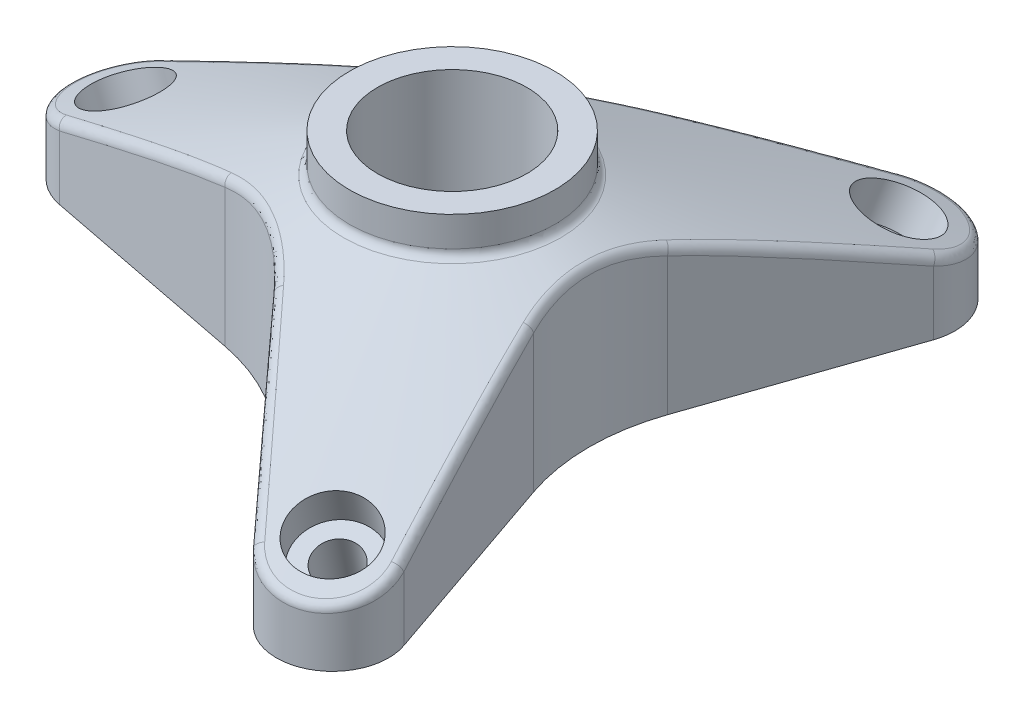
from build123d import *

# Parameters (mm, degrees)
SKETCH1_R                                = 8
BOSS_EXTRUDE1_DEPTH                      = 22
SKETCH1_3_R                              = 11
SKETCH1_3_R_2                            = 8
BOSS_EXTRUDE2_DEPTH                      = 22
CBORE_FOR_M4_SHCS1_D                     = 4.5
CBORE_FOR_M4_SHCS1_CBORE_D               = 8
CBORE_FOR_M4_SHCS1_CBORE_DEPTH           = 4
CBORE_FOR_M4_SHCS1_ON_FACE_2_D           = 4.5
CBORE_FOR_M4_SHCS1_ON_FACE_2_CBORE_D     = 8
CBORE_FOR_M4_SHCS1_ON_FACE_2_CBORE_DEPTH = 4
CBORE_FOR_M4_SHCS1_ON_FACE_3_D           = 4.5
CBORE_FOR_M4_SHCS1_ON_FACE_3_CBORE_D     = 8
CBORE_FOR_M4_SHCS1_ON_FACE_3_CBORE_DEPTH = 4
FILLET1_R                                = 1


with BuildPart() as part:
    # Sketch1 → Boss-Extrude1 (new body)
    with BuildSketch(Plane(origin=(0, 0, 0), x_dir=(1, 0, 0), z_dir=(0, 1, 0))):
        with BuildLine():
            Line((-14.140453582, 10.166985251), (-36.144853972, 5.889763101))
            ThreePointArc((-36.144853972, 5.889763101), (-41, 0), (-36.144853972, -5.889763101))
            Line((-36.144853972, -5.889763101), (-14.140453582, -10.166985251))
            ThreePointArc((-14.140453582, -10.166985251), (-7.338251481, -12.710224403), (-1.734640716, -17.329484649))
            Line((-1.734640716, -17.329484649), (12.971742519, -34.247243306))
            ThreePointArc((12.971742519, -34.247243306), (20.5, -35.507041555), (23.173111454, -28.357480206))
            Line((23.173111454, -28.357480206), (15.875094298, -7.162499398))
            ThreePointArc((15.875094298, -7.162499398), (14.676502962, 0), (15.875094298, 7.162499398))
            Line((15.875094298, 7.162499398), (23.173111454, 28.357480206))
            ThreePointArc((23.173111454, 28.357480206), (20.5, 35.507041555), (12.971742519, 34.247243306))
            Line((12.971742519, 34.247243306), (-1.734640716, 17.329484649))
            ThreePointArc((-1.734640716, 17.329484649), (-7.338251481, 12.710224403), (-14.140453582, 10.166985251))
        make_face()
        Circle(SKETCH1_R, mode=Mode.SUBTRACT)
    extrude(amount=BOSS_EXTRUDE1_DEPTH)

    # Sketch2 → Cut-Revolve1 (revolve, cut)
    with BuildSketch(Plane.XY):
        Polygon((-41, 6), (-1.398610345, 22), (-41, 22), align=None)
    revolve(axis=Axis((0, 0, 0), (0, 1, 0)), mode=Mode.SUBTRACT)

    # Sketch1<3> → Boss-Extrude2 (add)
    with BuildSketch(Plane(origin=(0, 0, 0), x_dir=(1, 0, 0), z_dir=(0, 1, 0))):
        Circle(SKETCH1_3_R)
        Circle(SKETCH1_3_R_2, mode=Mode.SUBTRACT)
    extrude(amount=BOSS_EXTRUDE2_DEPTH)

    # CBORE for M4 SHCS1 (through all)
    with Locations(Plane(origin=(-35, 8.424157355, 0), x_dir=(0.927183854567, 0.374606593416, 0), z_dir=(-0.374606593416, 0.927183854567, 0))):
        with Locations((0, 0)):
            CounterBoreHole(CBORE_FOR_M4_SHCS1_D / 2, CBORE_FOR_M4_SHCS1_CBORE_D / 2, CBORE_FOR_M4_SHCS1_CBORE_DEPTH)

    # CBORE for M4 SHCS1 on face 2 (through all)
    with Locations(Plane(origin=(17.5, 8.424157355, -30.310889132), x_dir=(0, 0.330263903272, 0.943888634424), z_dir=(0.187302974599, 0.927183874262, -0.324418956005))):
        with Locations((0, 0)):
            CounterBoreHole(CBORE_FOR_M4_SHCS1_ON_FACE_2_D / 2, CBORE_FOR_M4_SHCS1_ON_FACE_2_CBORE_D / 2, CBORE_FOR_M4_SHCS1_ON_FACE_2_CBORE_DEPTH)

    # CBORE for M4 SHCS1 on face 3 (through all)
    with Locations(Plane(origin=(17.5, 8.424157355, 30.310889132), x_dir=(0, -0.330263903272, 0.943888634424), z_dir=(0.187302974599, 0.927183874262, 0.324418956005))):
        with Locations((0, 0)):
            CounterBoreHole(CBORE_FOR_M4_SHCS1_ON_FACE_3_D / 2, CBORE_FOR_M4_SHCS1_ON_FACE_3_CBORE_D / 2, CBORE_FOR_M4_SHCS1_ON_FACE_3_CBORE_DEPTH)

    # Fillet1
    fillet1_edges = [part.edges().sort_by_distance(p)[0] for p in [
        (14.676502962, 16.635383159, 0),
        (19.549141875, 11.874214301, -17.832708334),
        (20.5, 6, -35.507041555),
        (5.669007498, 11.874214301, -25.846407652),
        (-7.338251481, 16.635383159, -12.710224403),
        (-25.218149373, 11.874214301, -8.013699319),
        (-39.578631173, 6.497707698, -3.877645752),
        (-25.218149373, 11.874214301, 8.013699319),
        (-7.33825148, 16.635383159, 12.710224404),
        (5.669007498, 11.874214301, 25.846407652),
        (20.5, 6, 35.507041555),
        (19.549141875, 11.874214301, 17.832708334),
        (0, 18.120786775, -11),
    ]]
    fillet(fillet1_edges, radius=FILLET1_R)


solid = part.part
